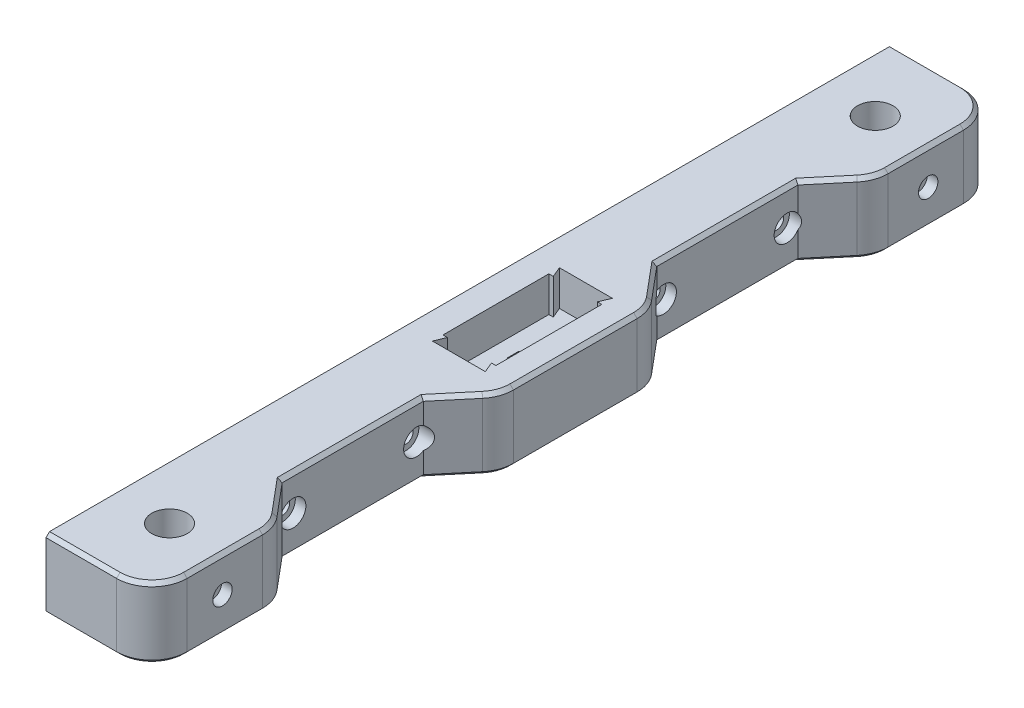
from build123d import *

# Parameters (mm, degrees)
SKETCH1_W               = 240
SKETCH1_H               = 20
BOSS_EXTRUDE1_DEPTH     = 30
SKETCH2_R               = 5.025
CUT_EXTRUDE1_DEPTH      = 20
SKETCH3_R               = 2.05
CUT_EXTRUDE2_DEPTH      = 30
SKETCH4_W               = 15
SKETCH4_H               = 30
CUT_EXTRUDE3_DEPTH      = 10
CUT_EXTRUDE4_DEPTH      = 2.5
CUT_EXTRUDE5_DEPTH      = 32.5
FILLET1_R               = 10
FILLET2_R               = 10
CHAMFER1_SIZE           = 1
CHAMFER2_SIZE           = 1
SKETCH7_R               = 1.6
CUT_EXTRUDE6_DEPTH      = 32.5
CUT_EXTRUDE7_DEPTH      = 10
SKETCH9_R               = 3
CUT_EXTRUDE8_DEPTH      = 3
FILLET3_R               = 1
CUT_EXTRUDE9_DEPTH      = 3
CUT_EXTRUDE9_DEPTH_BACK = 3
SKETCH10_R              = 3.65
SKETCH11_R              = 1.5
CUT_EXTRUDE10_DEPTH     = 13
SKETCH12_R              = 2.75
SKETCH12_R_2            = 1.5
CUT_EXTRUDE11_DEPTH     = 3


with BuildPart() as part:
    # Sketch1 → Boss-Extrude1 (new body)
    with BuildSketch(Plane(origin=(0, 0, 0), x_dir=(0, 0, -1), z_dir=(1, 0, 0))):
        with Locations((47.599764496, 4.521643901)):
            Rectangle(SKETCH1_W, SKETCH1_H)
    extrude(amount=BOSS_EXTRUDE1_DEPTH)

    # Sketch2 → Cut-Extrude1 (cut)
    with BuildSketch(Plane(origin=(0, 14.521643901, 0), x_dir=(1, 0, 0), z_dir=(0, 1, 0))):
        with Locations(Location((15, 147.599764496, 0), (0, 0, 270))):
            Circle(SKETCH2_R)
        with Locations(Location((15, -52.400235504, 0), (0, 0, 270))):
            Circle(SKETCH2_R)
    extrude(amount=-CUT_EXTRUDE1_DEPTH, mode=Mode.SUBTRACT)

    # Sketch3 → Cut-Extrude2 (cut)
    with BuildSketch(Plane(origin=(30, 0, 0), x_dir=(0, 0, -1), z_dir=(1, 0, 0))):
        with Locations((117.599764496, 4.521643901)):
            Circle(SKETCH3_R)
        with Locations((-22.400235504, 4.521643901)):
            Circle(SKETCH3_R)
        with Locations((12.599764496, 4.521643901)):
            Circle(SKETCH3_R)
        with Locations((82.599764496, 4.521643901)):
            Circle(SKETCH3_R)
    extrude(amount=-CUT_EXTRUDE2_DEPTH, mode=Mode.SUBTRACT)

    # Sketch4 → Cut-Extrude3 (cut)
    with BuildSketch(Plane(origin=(0, 14.521643901, 0), x_dir=(1, 0, 0), z_dir=(0, 1, 0))):
        with Locations((15, 47.599764496)):
            Rectangle(SKETCH4_W, SKETCH4_H)
    extrude(amount=-CUT_EXTRUDE3_DEPTH, mode=Mode.SUBTRACT)

    # Sketch5 → Cut-Extrude4 (cut)
    with BuildSketch(Plane(origin=(0, 4.521643901, 0), x_dir=(1, 0, 0), z_dir=(0, 1, 0))):
        Polygon((15, 44.424338015), (17.75, 46.012051256), (17.75, 49.187477736), (15, 50.775190977), (12.25, 49.187477736), (12.25, 46.012051256), align=None)
    extrude(amount=-CUT_EXTRUDE4_DEPTH, mode=Mode.SUBTRACT)

    # Sketch6 → Cut-Extrude5 (cut)
    with BuildSketch(Plane.XZ.offset(5.478356099)):
        Polygon((30, 37.400235504), (20, 25.482699578), (20, -14.517300422), (30, -26.434836348), align=None)
        Polygon((30, -68.764692644), (20, -80.68222857), (20, -120.68222857), (30, -132.599764496), align=None)
    extrude(amount=-CUT_EXTRUDE5_DEPTH, mode=Mode.SUBTRACT)

    # Fillet1
    fillet1_edges = [part.edges().sort_by_distance(p)[0] for p in [
        (30, 4.521643901, -68.764692644),
        (30, 4.521643901, -26.434836348),
    ]]
    fillet(fillet1_edges, radius=FILLET1_R)

    # Fillet2
    fillet2_edges = [part.edges().sort_by_distance(p)[0] for p in [
        (30, 4.521643901, -132.599764496),
        (30, 4.521643901, 72.400235504),
        (30, 4.521643901, -167.599764496),
        (30, 4.521643901, 37.400235504),
    ]]
    fillet(fillet2_edges, radius=FILLET2_R)

    # Chamfer1
    chamfer1_edges = [part.edges().sort_by_distance(p)[0] for p in [
        (20, -5.478356099, -100.68222857),
        (23.830222216, -5.478356099, -125.246909656),
        (30, -5.478356099, -47.599764496),
        (23.830222216, -5.478356099, -76.117547484),
        (29.396926208, -5.478356099, -68.545191735),
        (29.396926208, -5.478356099, -26.654337257),
        (30, -5.478356099, 51.720086675),
        (23.830222216, -5.478356099, 30.047380664),
        (10, -5.478356099, 72.400235504),
        (10, -5.478356099, -167.599764496),
        (30, -5.478356099, -146.919615667),
        (29.396926208, -5.478356099, 37.619736413),
        (29.396926208, -5.478356099, -132.819265405),
        (27.071067812, -5.478356099, -164.670832308),
        (27.071067812, -5.478356099, 69.471303316),
        (20, -5.478356099, 5.482699578),
        (23.830222216, -5.478356099, -19.081981508),
    ]]
    chamfer(chamfer1_edges, length=CHAMFER1_SIZE)

    # Chamfer2
    chamfer2_edges = [part.edges().sort_by_distance(p)[0] for p in [
        (23.830222216, 14.521643901, -125.246909656),
        (20, 14.521643901, -100.68222857),
        (30, 14.521643901, -47.599764496),
        (23.830222216, 14.521643901, -76.117547484),
        (29.396926208, 14.521643901, -68.545191735),
        (29.396926208, 14.521643901, -26.654337257),
        (30, 14.521643901, 51.720086675),
        (10, 14.521643901, 72.400235504),
        (30, 14.521643901, -146.919615667),
        (10, 14.521643901, -167.599764496),
        (23.830222216, 14.521643901, 30.047380664),
        (29.396926208, 14.521643901, 37.619736413),
        (29.396926208, 14.521643901, -132.819265405),
        (27.071067812, 14.521643901, -164.670832308),
        (27.071067812, 14.521643901, 69.471303316),
        (23.830222216, 14.521643901, -19.081981508),
        (20, 14.521643901, 5.482699578),
    ]]
    chamfer(chamfer2_edges, length=CHAMFER2_SIZE)

    # Sketch7 → Cut-Extrude6 (cut)
    with BuildSketch(Plane(origin=(0, 2.021643901, 0), x_dir=(1, 0, 0), z_dir=(0, 1, 0))):
        with Locations(Location((15, 47.599764496, 0), (0, 0, 270))):
            Circle(SKETCH7_R)
    extrude(amount=-CUT_EXTRUDE6_DEPTH, mode=Mode.SUBTRACT)

    # Sketch8 → Cut-Extrude7 (cut)
    with BuildSketch(Plane(origin=(0, 14.521643901, 0), x_dir=(1, 0, 0), z_dir=(0, 1, 0))):
        Polygon((7.5, 65.599764496), (8.75, 62.599764496), (21.25, 62.599764496), (22.5, 65.599764496), align=None)
        Polygon((21.25, 32.599764496), (8.75, 32.599764496), (7.5, 29.599764496), (22.5, 29.599764496), align=None)
    extrude(amount=-CUT_EXTRUDE7_DEPTH, mode=Mode.SUBTRACT)

    # Sketch9 → Cut-Extrude8 (cut)
    with BuildSketch(Plane.XZ.offset(5.478356099)):
        with Locations(Location((15, -47.599764496, 0), (0, 0, 270))):
            Circle(SKETCH9_R)
    extrude(amount=-CUT_EXTRUDE8_DEPTH, mode=Mode.SUBTRACT)

    # Fillet3
    fillet3_edges = [part.edges().sort_by_distance(p)[0] for p in [
        (15, -5.478356099, -44.599764496),
    ]]
    fillet(fillet3_edges, radius=FILLET3_R)

    # Sketch10 → Cut-Extrude9 (cut, two sides: drawn at the far end of the back side and taken through both)
    with BuildSketch(Plane(origin=(20, 0, 0), x_dir=(0, 0, -1), z_dir=(1, 0, 0)).offset(-CUT_EXTRUDE9_DEPTH_BACK)):
        with Locations(Location((12.599764496, 4.521643901, 0), (0, 0, 301.691963515))):
            Circle(SKETCH10_R)
        with Locations(Location((-22.400235504, 4.521643901, 0), (0, 0, 147.61954983))):
            Circle(SKETCH10_R)
        with Locations(Location((82.599764496, 4.521643901, 0), (0, 0, 238.308036485))):
            Circle(SKETCH10_R)
        with Locations(Location((117.599764496, 4.521643901, 0), (0, 0, 327.61954983))):
            Circle(SKETCH10_R)
    extrude(amount=CUT_EXTRUDE9_DEPTH + CUT_EXTRUDE9_DEPTH_BACK, mode=Mode.SUBTRACT)

    # Sketch11 → Cut-Extrude10 (cut)
    with BuildSketch(Plane(origin=(30, 0, 0), x_dir=(0, 0, -1), z_dir=(1, 0, 0))):
        with Locations((147.599764496, 4.521643901)):
            Circle(SKETCH11_R)
        with Locations((-52.400235504, 4.521643901)):
            Circle(SKETCH11_R)
    extrude(amount=-CUT_EXTRUDE10_DEPTH, mode=Mode.SUBTRACT)

    # Sketch12 → Cut-Extrude11 (cut)
    # profile 1 of 2: a face of its own
    with BuildSketch(Plane(origin=(30, 0, 0), x_dir=(0, 0, -1), z_dir=(1, 0, 0))):
        with Locations((-52.400235504, 4.521643901)):
            Circle(SKETCH12_R)
        with Locations((-52.400235504, 4.521643901)):
            Circle(SKETCH12_R_2, mode=Mode.SUBTRACT)
    # profile 2 of 2: a face of its own
    with BuildSketch(Plane(origin=(30, 0, 0), x_dir=(0, 0, -1), z_dir=(1, 0, 0))):
        with Locations((147.599764496, 4.521643901)):
            Circle(SKETCH12_R)
        with Locations((147.599764496, 4.521643901)):
            Circle(SKETCH12_R_2, mode=Mode.SUBTRACT)
    extrude(amount=-CUT_EXTRUDE11_DEPTH, mode=Mode.SUBTRACT)


solid = part.part
